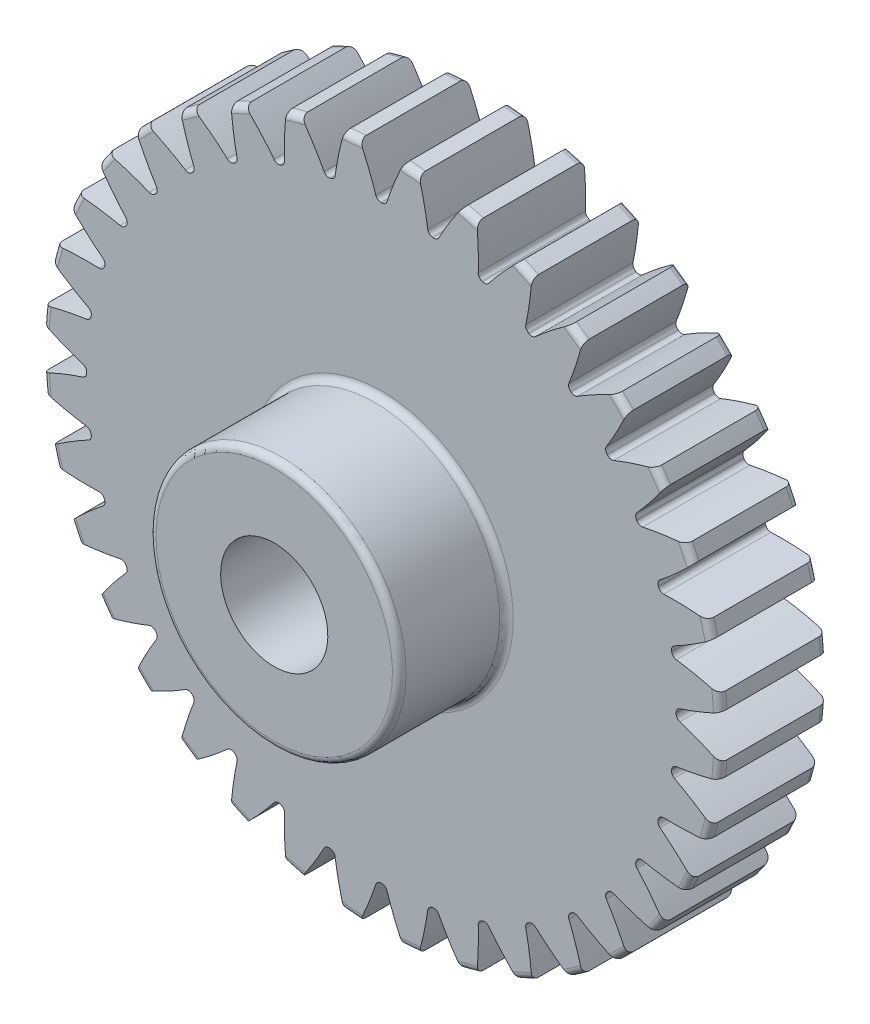
from build123d import *

# Parameters (mm, degrees)
FILLET2_R          = 0.38
CUT_EXTRUDE2_DEPTH = 28.531799796
CIRPATTERN1_COUNT  = 36


with BuildPart() as part:
    # Sketch4 → Revolve1 (revolve)
    with BuildSketch(Plane(origin=(0, 0, 0), x_dir=(0, 0, -1), z_dir=(1, 0, 0))):
        Polygon((-12, 3), (-12, 7), (-6, 7), (-6, 19), (0, 19), (0, 3), align=None)
    revolve(axis=Axis((0, 0, 6), (0, 0, 1)))

    # Fillet2
    fillet2_edges = [part.edges().sort_by_distance(p)[0] for p in [
        (0, -19, 0),
        (0, -19, 6),
        (0, -7, 6),
        (0, -7, 12),
    ]]
    fillet(fillet2_edges, radius=FILLET2_R)

    # Sketch7 → Cut-Extrude2 (cut, through all)
    with BuildSketch(Plane.XY.offset(6)):
        with BuildLine():
            ThreePointArc((-0.026603161, 16.499978554), (0, 16.5), (0.026603161, 16.499978554))
            ThreePointArc((0.026603161, 16.499978554), (0.20288747, 16.556880155), (0.312154737, 16.706461619))
            ThreePointArc((0.312154737, 16.706461619), (0.730288505, 17.848903583), (1.224636785, 18.960492207))
            ThreePointArc((1.224636785, 18.960492207), (0, 19), (-1.224636785, 18.960492207))
            ThreePointArc((-1.224636785, 18.960492207), (-0.730288505, 17.848903583), (-0.312154737, 16.706461619))
            ThreePointArc((-0.312154737, 16.706461619), (-0.20288747, 16.556880155), (-0.026603161, 16.499978554))
        make_face()
    cut_extrude2 = extrude(amount=-CUT_EXTRUDE2_DEPTH, mode=Mode.SUBTRACT)

    # CirPattern1: Cut-Extrude2 ×36 about axis
    cirpattern1_axis = Axis((0, 0, 0), (0, 0, 1))
    for i in range(1, CIRPATTERN1_COUNT):
        add(cut_extrude2.rotate(cirpattern1_axis, i * 360 / CIRPATTERN1_COUNT), mode=Mode.SUBTRACT)


solid = part.part
